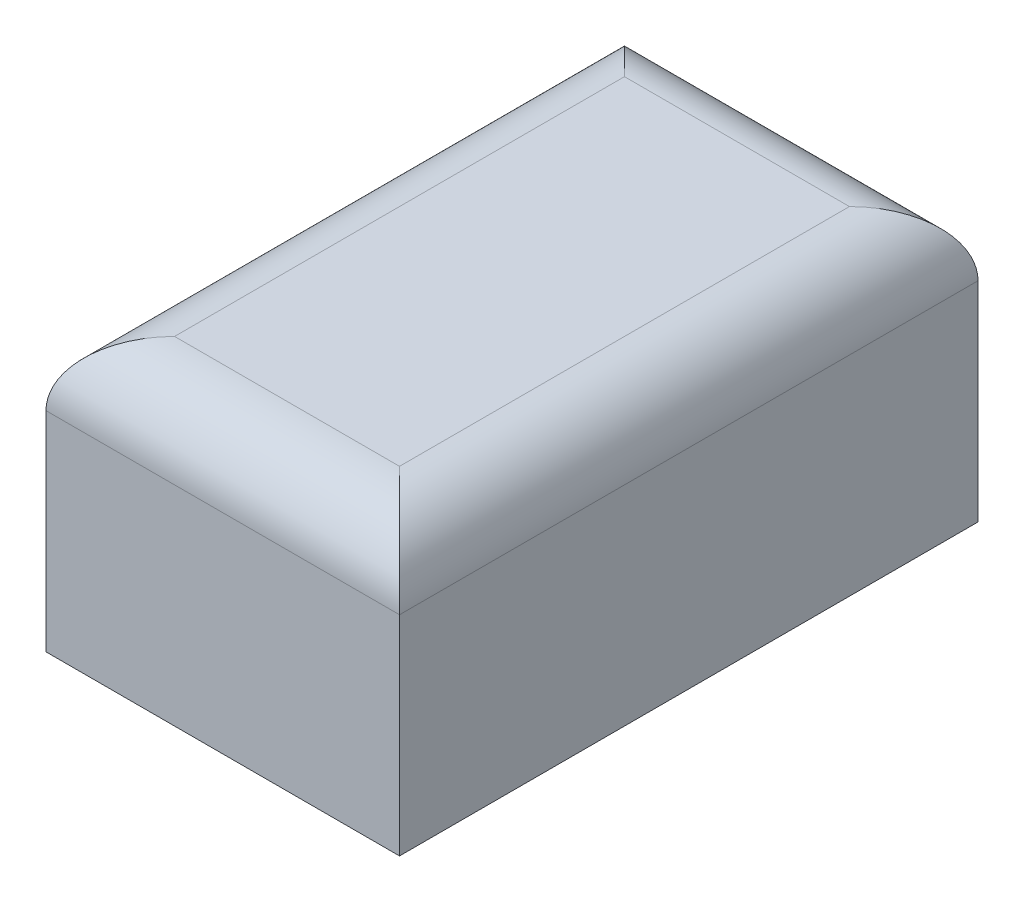
from build123d import *

# Parameters (mm, degrees)
SKETCH1_W           = 22
SKETCH1_H           = 36
BOSS_EXTRUDE1_DEPTH = 17
SKETCH2_W           = 16
SKETCH2_H           = 30
CUT_EXTRUDE1_DEPTH  = 14
FILLET1_R           = 4


with BuildPart() as part:
    # Sketch1 → Boss-Extrude1 (new body)
    with BuildSketch(Plane(origin=(0, 0, 0), x_dir=(1, 0, 0), z_dir=(0, 1, 0))):
        Rectangle(SKETCH1_W, SKETCH1_H)
    extrude(amount=BOSS_EXTRUDE1_DEPTH)

    # Sketch2 → Cut-Extrude1 (cut)
    with BuildSketch(Plane(origin=(0, 0, 0), x_dir=(-1, 0, 0), z_dir=(0, -1, 0))):
        Rectangle(SKETCH2_W, SKETCH2_H)
    extrude(amount=-CUT_EXTRUDE1_DEPTH, mode=Mode.SUBTRACT)

    # Fillet1
    fillet1_edges = [part.edges().sort_by_distance(p)[0] for p in [
        (-11, 17, 0),
        (0, 17, 18),
        (11, 17, 0),
        (0, 17, -18),
    ]]
    fillet(fillet1_edges, radius=FILLET1_R)


solid = part.part
